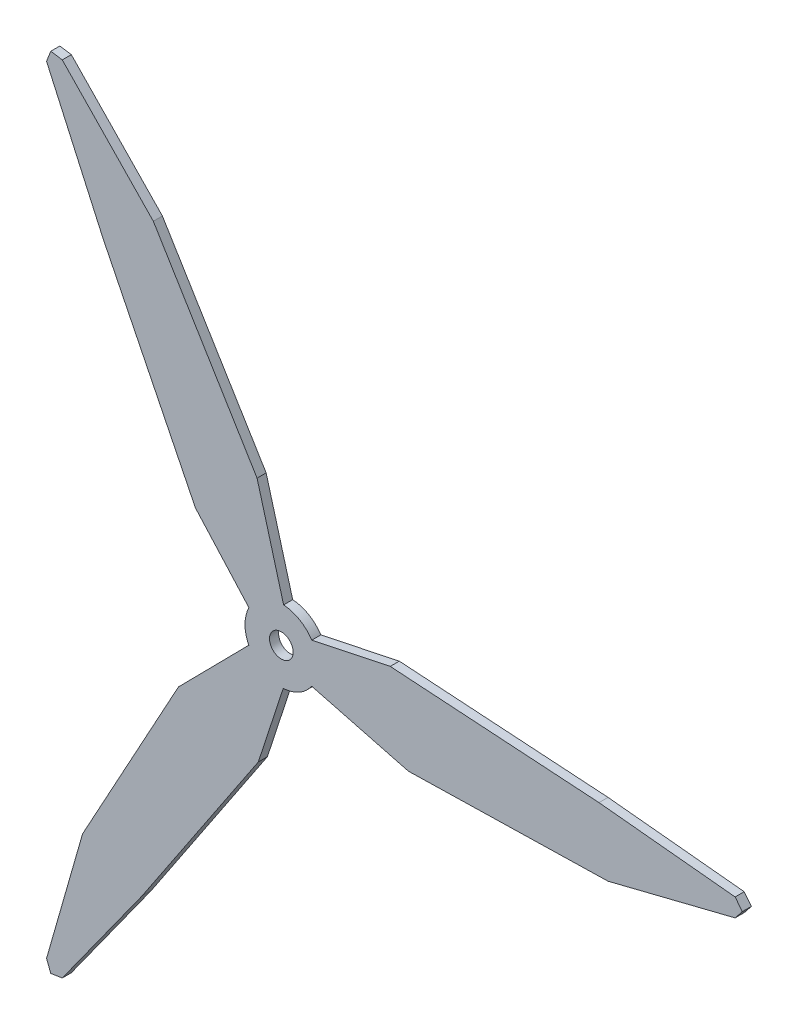
from build123d import *

# Parameters (mm, degrees)
SKETCH_1_R          = 8
SKETCH_1_R_2        = 2.6
EXTRUDE_215_DEPTH   = 2
EXTRUDE_8_120_DEPTH = 2


with BuildPart() as part:
    # 草图1 → Extrude 215 (new body)
    with BuildSketch(Plane.XY):
        Circle(SKETCH_1_R)
        Circle(SKETCH_1_R_2, mode=Mode.SUBTRACT)
    extrude(amount=EXTRUDE_215_DEPTH)

    # 草图2 → 8寸三叶桨轮廓_120度均布 (add)
    with BuildSketch(Plane.XY):
        Polygon((5, -4), (28, -10), (72, -9), (100, -2), (101.6, 0), (100, 2), (70, 5), (24, 8), (5, 4), align=None)
        Polygon((0.964101615, 6.330127019), (-5.339745962, 29.248711306), (-28.205771366, 66.853829072), (-48.267949192, 87.602540378), (-50.8, 87.988181024), (-51.732050808, 85.602540378), (-39.330127019, 58.121778265), (-18.92820323, 16.784609691), (-5.964101615, 2.330127019), align=None)
        Polygon((-5.964101615, -2.330127019), (-22.660254038, -19.248711306), (-43.794228634, -57.853829072), (-51.732050808, -85.602540378), (-50.8, -87.988181024), (-48.267949192, -87.602540378), (-30.669872981, -63.121778265), (-5.07179677, -24.784609691), (0.964101615, -6.330127019), align=None)
    extrude(amount=EXTRUDE_8_120_DEPTH)


solid = part.part
